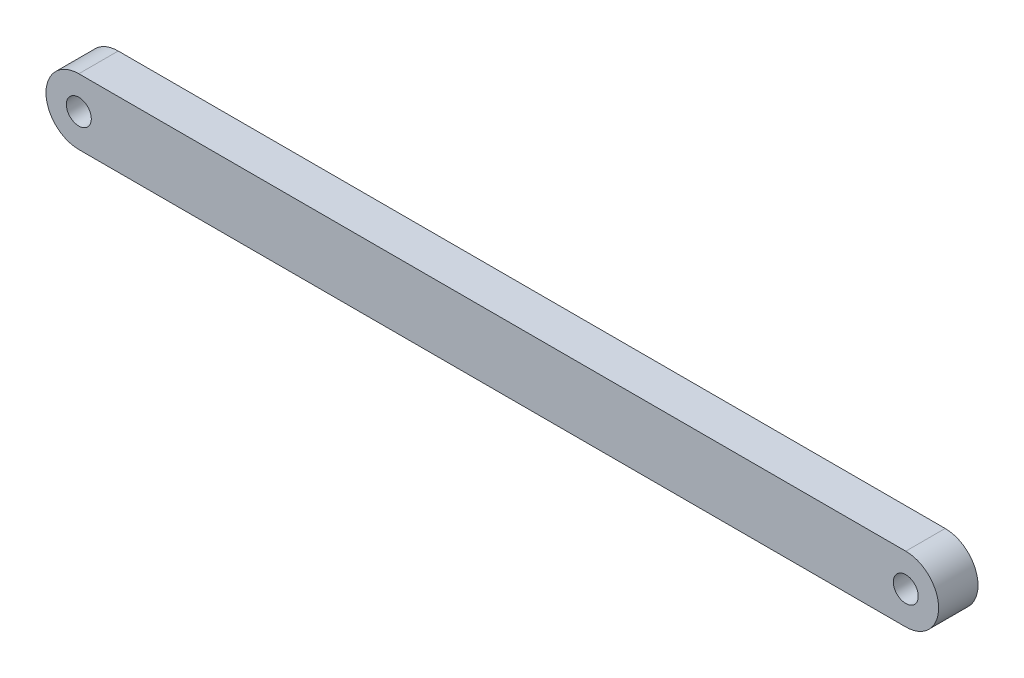
from build123d import *

# Parameters (mm, degrees)
SKETCH1_R           = 1.9
BOSS_EXTRUDE1_DEPTH = 6


with BuildPart() as part:
    # Sketch1 → Boss-Extrude1 (new body)
    with BuildSketch(Plane.XY):
        with BuildLine():
            Line((-62.97405025, 5), (62.97405025, 5))
            ThreePointArc((62.97405025, 5), (67.97405025, 0), (62.97405025, -5))
            Line((62.97405025, -5), (-62.97405025, -5))
            ThreePointArc((-62.97405025, -5), (-67.97405025, 0), (-62.97405025, 5))
        make_face()
        with Locations((-62.97405025, 0)):
            Circle(SKETCH1_R, mode=Mode.SUBTRACT)
        with Locations((62.97405025, 0)):
            Circle(SKETCH1_R, mode=Mode.SUBTRACT)
    extrude(amount=BOSS_EXTRUDE1_DEPTH)


solid = part.part
